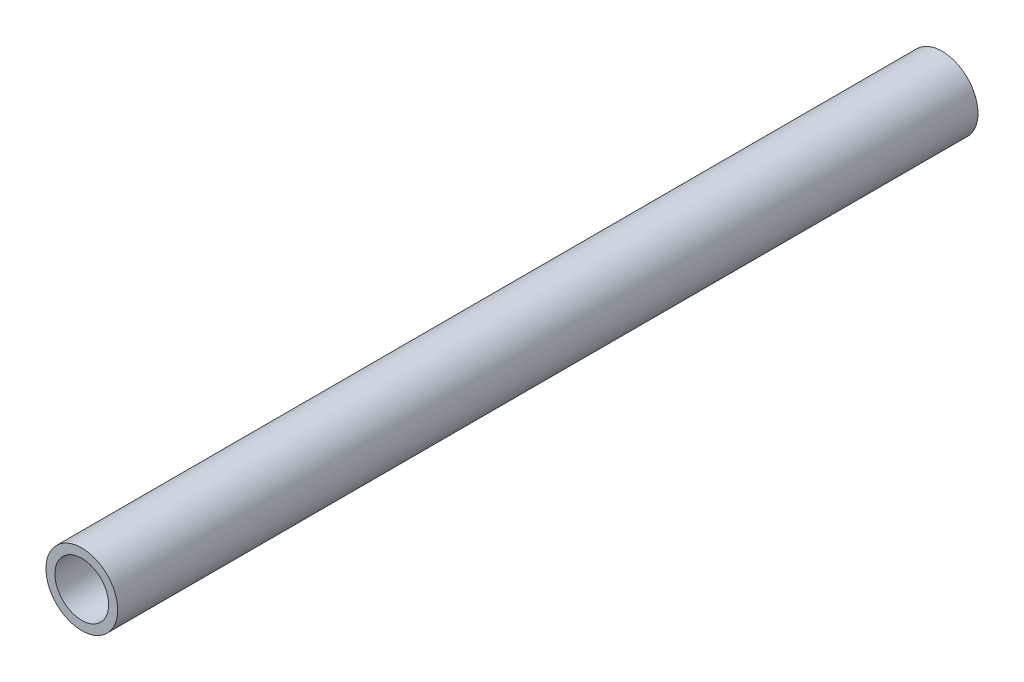
from build123d import *

# Parameters (mm, degrees)
SKETCH_1_R          = 4
EXTRUDE_1_DEPTH     = 48
SKETCH_2_R          = 3
CUT_EXTRUDE_1_DEPTH = 100


with BuildPart() as part:
    # 草图1 → 凸台-拉伸1 (new, symmetric)
    with BuildSketch(Plane.XY):
        Circle(SKETCH_1_R)
    extrude(amount=EXTRUDE_1_DEPTH, both=True)

    # 草图2 → 切除-拉伸1 (cut)
    with BuildSketch(Plane.XY.offset(48)):
        Circle(SKETCH_2_R)
    extrude(amount=-CUT_EXTRUDE_1_DEPTH, mode=Mode.SUBTRACT)


solid = part.part
